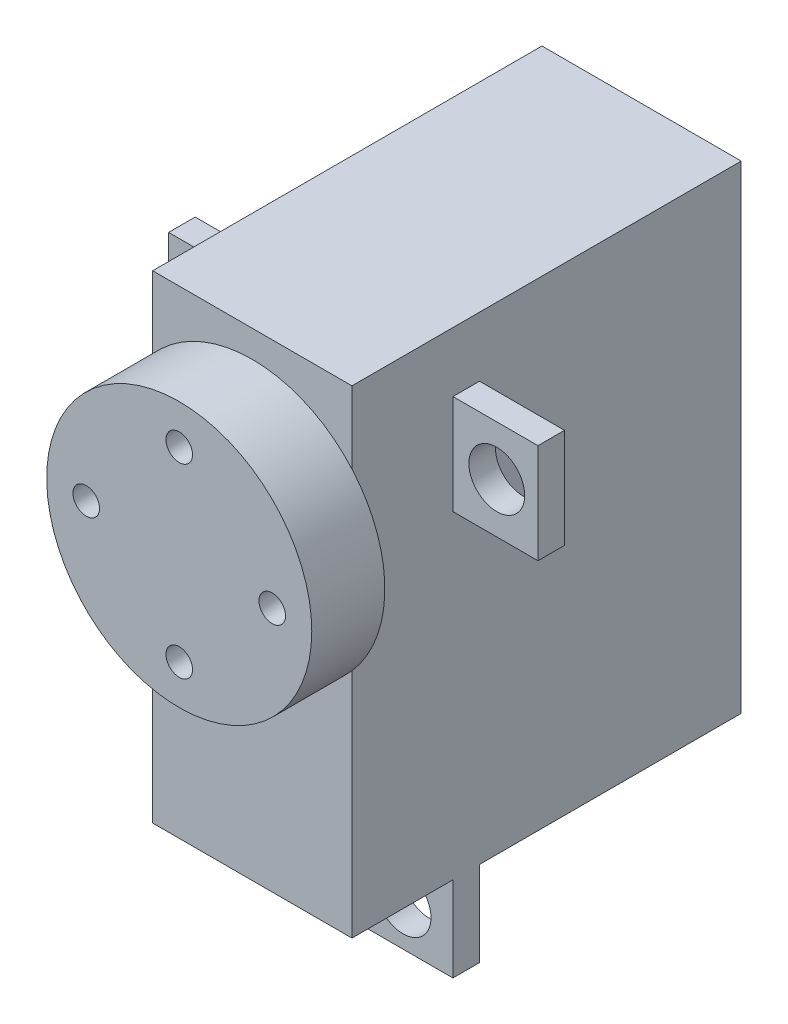
from build123d import *

# Parameters (mm, degrees)
SKETCH_1_W      = 15
SKETCH_1_H      = 36
EXTRUDE_1_DEPTH = 29.3
SKETCH_2_R      = 9.975
SKETCH_2_R_2    = 1
EXTRUDE_2_DEPTH = 5.5
EXTRUDE_START   = -19.7
SKETCH_3_W      = 15
SKETCH_3_H      = 6.4
SKETCH_3_R      = 2.1
SKETCH_3_W_2    = 6.4
SKETCH_3_H_2    = 7.5
EXTRUDE_3_DEPTH = 2
SKETCH_4_W      = 6
SKETCH_4_H      = 5
EXTRUDE_4_DEPTH = 4


with BuildPart() as part:
    # 스케치1 → 보스-돌출1 (new body)
    with BuildSketch(Plane.XY):
        Rectangle(SKETCH_1_W, SKETCH_1_H)
    extrude(amount=EXTRUDE_1_DEPTH)

    # 스케치2 → 보스-돌출2 (add)
    with BuildSketch(Plane.XY.offset(29.3)):
        with Locations(Location((0, 6, 0), (0, 0, 221.246533369))):
            Circle(SKETCH_2_R)
        with Locations((0, 13)):
            Circle(SKETCH_2_R_2, mode=Mode.SUBTRACT)
        with Locations(Location((7, 6, 0), (0, 0, 60))):
            Circle(SKETCH_2_R_2, mode=Mode.SUBTRACT)
        with Locations((0, -1)):
            Circle(SKETCH_2_R_2, mode=Mode.SUBTRACT)
        with Locations(Location((-7, 6, 0), (0, 0, 120))):
            Circle(SKETCH_2_R_2, mode=Mode.SUBTRACT)
    extrude(amount=EXTRUDE_2_DEPTH)

    # 스케치3 → 보스-돌출3 (add)
    # profile 1 of 3: a face of its own
    with BuildSketch(Plane(origin=(0, 0, 0), x_dir=(-1, 0, 0), z_dir=(0, 0, -1)).offset(EXTRUDE_START)):
        with Locations((0, -21.2)):
            Rectangle(SKETCH_3_W, SKETCH_3_H)
        with Locations((-3.75, -21.3)):
            Circle(SKETCH_3_R, mode=Mode.SUBTRACT)
        with Locations((3.75, -21.3)):
            Circle(SKETCH_3_R, mode=Mode.SUBTRACT)
    # profile 2 of 3: a face of its own
    with BuildSketch(Plane(origin=(0, 0, 0), x_dir=(-1, 0, 0), z_dir=(0, 0, -1)).offset(EXTRUDE_START)):
        with Locations((-10.7, 9.75)):
            Rectangle(SKETCH_3_W_2, SKETCH_3_H_2)
        with Locations((-10.8, 9.75)):
            Circle(SKETCH_3_R, mode=Mode.SUBTRACT)
    # profile 3 of 3: a face of its own
    with BuildSketch(Plane(origin=(0, 0, 0), x_dir=(-1, 0, 0), z_dir=(0, 0, -1)).offset(EXTRUDE_START)):
        with Locations((10.7, 9.75)):
            Rectangle(SKETCH_3_W_2, SKETCH_3_H_2)
        with Locations((10.8, 9.75)):
            Circle(SKETCH_3_R, mode=Mode.SUBTRACT)
    extrude(amount=-EXTRUDE_3_DEPTH)

    # 스케치4 → 보스-돌출4 (add)
    with BuildSketch(Plane.XZ.offset(18)):
        with Locations((0, 2.5)):
            Rectangle(SKETCH_4_W, SKETCH_4_H)
    extrude(amount=EXTRUDE_4_DEPTH)


solid = part.part
